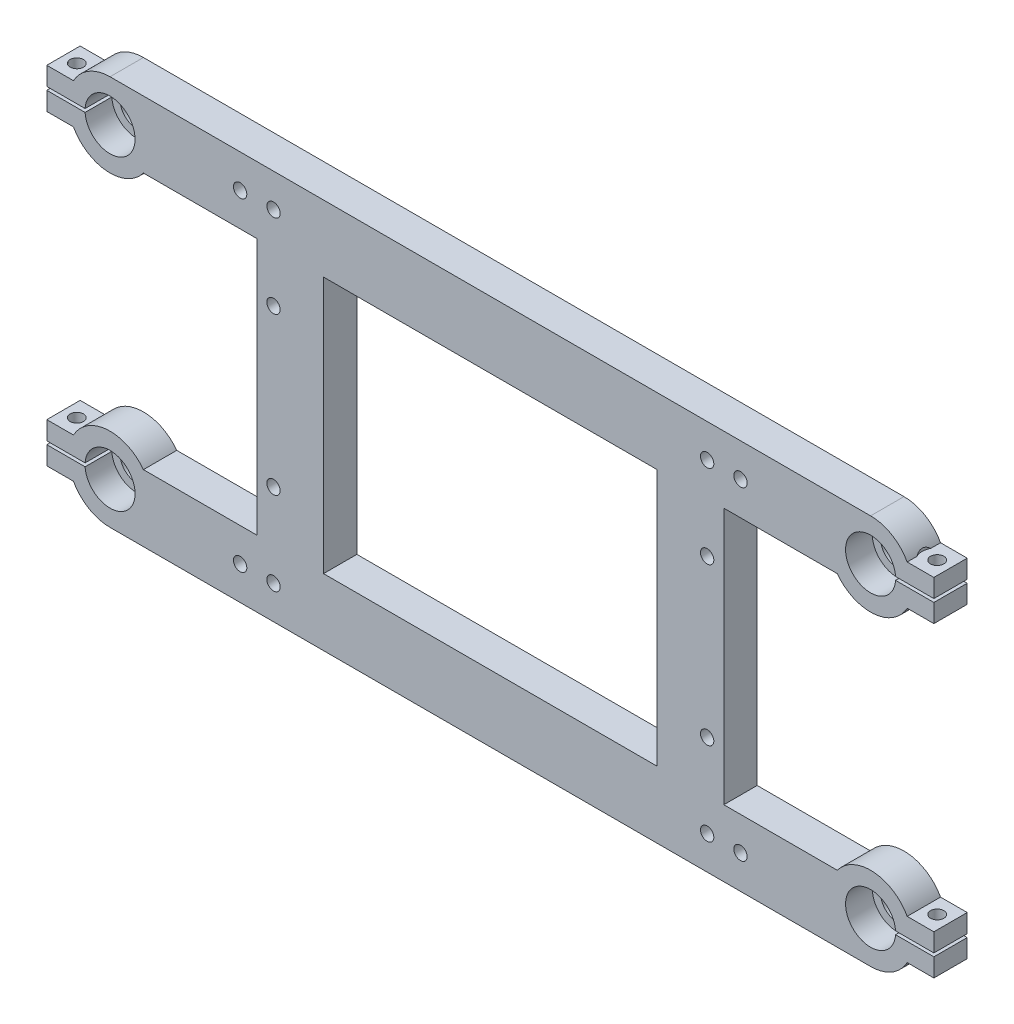
from build123d import *

# Parameters (mm, degrees)
SKETCH_1_R          = 5
SKETCH_1_W          = 100
SKETCH_1_H          = 77
EXTRUDE_1_DEPTH     = 10
SKETCH_3_R          = 7.5
CUT_EXTRUDE_1_DEPTH = 8
CUT_EXTRUDE_2_REACH = 166.385
SKETCH_5_R          = 2
SKETCH_6_W          = 8
SKETCH_6_H          = 12
EXTRUDE_2_DEPTH     = 10
SKETCH_7_W          = 15
SKETCH_7_H          = 1
CUT_EXTRUDE_3_DEPTH = 170.411241918
SKETCH_8_R          = 2
CUT_EXTRUDE_4_DEPTH = 174.176698457
SKETCH_9_R          = 4.5
CUT_EXTRUDE_5_DEPTH = 10
CHAMFER_1_SIZE      = 2


with BuildPart() as part:
    # 草图1 → 凸台-拉伸1 (new body)
    with BuildSketch(Plane.XY):
        with BuildLine():
            Line((-104, 84.5), (-70, 84.5))
            Line((-70, 84.5), (-70, 7.5))
            Line((-70, 7.5), (-104, 7.5))
            ThreePointArc((-104, 7.5), (-125.180339887, 5.590169944), (-114, -12.5))
            Line((-114, -12.5), (114, -12.5))
            ThreePointArc((114, -12.5), (125.180339887, 5.590169944), (104, 7.5))
            Line((104, 7.5), (70, 7.5))
            Line((70, 7.5), (70, 84.5))
            Line((70, 84.5), (104, 84.5))
            ThreePointArc((104, 84.5), (125.180339887, 86.409830056), (114, 104.5))
            Line((114, 104.5), (64, 104.5))
            Line((64, 104.5), (-64, 104.5))
            Line((-64, 104.5), (-114, 104.5))
            ThreePointArc((-114, 104.5), (-125.180339887, 86.409830056), (-104, 84.5))
        make_face()
        with Locations((-114, 0)):
            Circle(SKETCH_1_R, mode=Mode.SUBTRACT)
        with Locations((-114, 92)):
            Circle(SKETCH_1_R, mode=Mode.SUBTRACT)
        with Locations(Location((114, 92, 0), (0, 0, 180))):
            Circle(SKETCH_1_R, mode=Mode.SUBTRACT)
        with Locations(Location((114, 0, 0), (0, 0, 180))):
            Circle(SKETCH_1_R, mode=Mode.SUBTRACT)
        with Locations((0, 46)):
            Rectangle(SKETCH_1_W, SKETCH_1_H, mode=Mode.SUBTRACT)
    extrude(amount=EXTRUDE_1_DEPTH)

    # 草图3 → 切除-拉伸1 (cut)
    with BuildSketch(Plane.XY.offset(10)):
        with Locations((-114, 92)):
            Circle(SKETCH_3_R)
        with Locations((-114, 0)):
            Circle(SKETCH_3_R)
        with Locations(Location((114, 0, 0), (0, 0, 180))):
            Circle(SKETCH_3_R)
        with Locations(Location((114, 92, 0), (0, 0, 180))):
            Circle(SKETCH_3_R)
    extrude(amount=-CUT_EXTRUDE_1_DEPTH, mode=Mode.SUBTRACT)

    # 草图5 → 切除-拉伸2 (cut, up to next)
    with BuildSketch(Plane.XY, mode=Mode.PRIVATE) as cut_extrude_2_sk1:
        with Locations(Location((-65, 94.5, 0), (0, 0, 180))):
            Circle(SKETCH_5_R)
    cut_extrude_2_tool1 = extrude(cut_extrude_2_sk1.sketch, amount=CUT_EXTRUDE_2_REACH, mode=Mode.PRIVATE) & part.part
    # 草图5 → 切除-拉伸2 (cut, up to next)
    with BuildSketch(Plane.XY, mode=Mode.PRIVATE) as cut_extrude_2_sk2:
        with Locations(Location((-75, 94.5, 0), (0, 0, 180))):
            Circle(SKETCH_5_R)
    cut_extrude_2_tool2 = extrude(cut_extrude_2_sk2.sketch, amount=CUT_EXTRUDE_2_REACH, mode=Mode.PRIVATE) & part.part
    # 草图5 → 切除-拉伸2 (cut, up to next)
    with BuildSketch(Plane.XY, mode=Mode.PRIVATE) as cut_extrude_2_sk3:
        with Locations(Location((-65, 69.5, 0), (0, 0, 180))):
            Circle(SKETCH_5_R)
    cut_extrude_2_tool3 = extrude(cut_extrude_2_sk3.sketch, amount=CUT_EXTRUDE_2_REACH, mode=Mode.PRIVATE) & part.part
    # 草图5 → 切除-拉伸2 (cut, up to next)
    with BuildSketch(Plane.XY, mode=Mode.PRIVATE) as cut_extrude_2_sk4:
        with Locations(Location((-65, 22.5, 0), (0, 0, 180))):
            Circle(SKETCH_5_R)
    cut_extrude_2_tool4 = extrude(cut_extrude_2_sk4.sketch, amount=CUT_EXTRUDE_2_REACH, mode=Mode.PRIVATE) & part.part
    # 草图5 → 切除-拉伸2 (cut, up to next)
    with BuildSketch(Plane.XY, mode=Mode.PRIVATE) as cut_extrude_2_sk5:
        with Locations(Location((-65, -2.5, 0), (0, 0, 180))):
            Circle(SKETCH_5_R)
    cut_extrude_2_tool5 = extrude(cut_extrude_2_sk5.sketch, amount=CUT_EXTRUDE_2_REACH, mode=Mode.PRIVATE) & part.part
    # 草图5 → 切除-拉伸2 (cut, up to next)
    with BuildSketch(Plane.XY, mode=Mode.PRIVATE) as cut_extrude_2_sk6:
        with Locations(Location((-75, -2.5, 0), (0, 0, 180))):
            Circle(SKETCH_5_R)
    cut_extrude_2_tool6 = extrude(cut_extrude_2_sk6.sketch, amount=CUT_EXTRUDE_2_REACH, mode=Mode.PRIVATE) & part.part
    # 草图5 → 切除-拉伸2 (cut, up to next)
    with BuildSketch(Plane.XY, mode=Mode.PRIVATE) as cut_extrude_2_sk7:
        with Locations(Location((75, -2.5, 0), (0, 0, 180))):
            Circle(SKETCH_5_R)
    cut_extrude_2_tool7 = extrude(cut_extrude_2_sk7.sketch, amount=CUT_EXTRUDE_2_REACH, mode=Mode.PRIVATE) & part.part
    # 草图5 → 切除-拉伸2 (cut, up to next)
    with BuildSketch(Plane.XY, mode=Mode.PRIVATE) as cut_extrude_2_sk8:
        with Locations(Location((65, -2.5, 0), (0, 0, 180))):
            Circle(SKETCH_5_R)
    cut_extrude_2_tool8 = extrude(cut_extrude_2_sk8.sketch, amount=CUT_EXTRUDE_2_REACH, mode=Mode.PRIVATE) & part.part
    # 草图5 → 切除-拉伸2 (cut, up to next)
    with BuildSketch(Plane.XY, mode=Mode.PRIVATE) as cut_extrude_2_sk9:
        with Locations(Location((65, 22.5, 0), (0, 0, 180))):
            Circle(SKETCH_5_R)
    cut_extrude_2_tool9 = extrude(cut_extrude_2_sk9.sketch, amount=CUT_EXTRUDE_2_REACH, mode=Mode.PRIVATE) & part.part
    # 草图5 → 切除-拉伸2 (cut, up to next)
    with BuildSketch(Plane.XY, mode=Mode.PRIVATE) as cut_extrude_2_sk10:
        with Locations(Location((65, 69.5, 0), (0, 0, 180))):
            Circle(SKETCH_5_R)
    cut_extrude_2_tool10 = extrude(cut_extrude_2_sk10.sketch, amount=CUT_EXTRUDE_2_REACH, mode=Mode.PRIVATE) & part.part
    # 草图5 → 切除-拉伸2 (cut, up to next)
    with BuildSketch(Plane.XY, mode=Mode.PRIVATE) as cut_extrude_2_sk11:
        with Locations(Location((75, 94.5, 0), (0, 0, 180))):
            Circle(SKETCH_5_R)
    cut_extrude_2_tool11 = extrude(cut_extrude_2_sk11.sketch, amount=CUT_EXTRUDE_2_REACH, mode=Mode.PRIVATE) & part.part
    # 草图5 → 切除-拉伸2 (cut, up to next)
    with BuildSketch(Plane.XY, mode=Mode.PRIVATE) as cut_extrude_2_sk12:
        with Locations(Location((65, 94.5, 0), (0, 0, 180))):
            Circle(SKETCH_5_R)
    cut_extrude_2_tool12 = extrude(cut_extrude_2_sk12.sketch, amount=CUT_EXTRUDE_2_REACH, mode=Mode.PRIVATE) & part.part
    add(cut_extrude_2_tool1.solids().sort_by_distance((-65, 94.5, 0))[0], mode=Mode.SUBTRACT)
    add(cut_extrude_2_tool2.solids().sort_by_distance((-75, 94.5, 0))[0], mode=Mode.SUBTRACT)
    add(cut_extrude_2_tool3.solids().sort_by_distance((-65, 69.5, 0))[0], mode=Mode.SUBTRACT)
    add(cut_extrude_2_tool4.solids().sort_by_distance((-65, 22.5, 0))[0], mode=Mode.SUBTRACT)
    add(cut_extrude_2_tool5.solids().sort_by_distance((-65, -2.5, 0))[0], mode=Mode.SUBTRACT)
    add(cut_extrude_2_tool6.solids().sort_by_distance((-75, -2.5, 0))[0], mode=Mode.SUBTRACT)
    add(cut_extrude_2_tool7.solids().sort_by_distance((75, -2.5, 0))[0], mode=Mode.SUBTRACT)
    add(cut_extrude_2_tool8.solids().sort_by_distance((65, -2.5, 0))[0], mode=Mode.SUBTRACT)
    add(cut_extrude_2_tool9.solids().sort_by_distance((65, 22.5, 0))[0], mode=Mode.SUBTRACT)
    add(cut_extrude_2_tool10.solids().sort_by_distance((65, 69.5, 0))[0], mode=Mode.SUBTRACT)
    add(cut_extrude_2_tool11.solids().sort_by_distance((75, 94.5, 0))[0], mode=Mode.SUBTRACT)
    add(cut_extrude_2_tool12.solids().sort_by_distance((65, 94.5, 0))[0], mode=Mode.SUBTRACT)

    # 草图6 → 凸台-拉伸2 (add)
    with BuildSketch(Plane.XY.offset(10)):
        with Locations((128.9658561, 92)):
            Rectangle(SKETCH_6_W, SKETCH_6_H)
        with Locations((128.9658561, 0)):
            Rectangle(SKETCH_6_W, SKETCH_6_H)
        with Locations((-128.9658561, 0)):
            Rectangle(SKETCH_6_W, SKETCH_6_H)
        with Locations((-128.9658561, 92)):
            Rectangle(SKETCH_6_W, SKETCH_6_H)
    extrude(amount=-EXTRUDE_2_DEPTH)

    # 草图7 → 切除-拉伸3 (cut, through all)
    with BuildSketch(Plane.XY.offset(10)):
        with Locations((125.4658561, 92)):
            Rectangle(SKETCH_7_W, SKETCH_7_H)
        with Locations((125.4658561, 0)):
            Rectangle(SKETCH_7_W, SKETCH_7_H)
        with Locations((-125.4658561, 0)):
            Rectangle(SKETCH_7_W, SKETCH_7_H)
        with Locations((-125.4658561, 92)):
            Rectangle(SKETCH_7_W, SKETCH_7_H)
    extrude(amount=-CUT_EXTRUDE_3_DEPTH, mode=Mode.SUBTRACT)

    # 草图8 → 切除-拉伸4 (cut, through all)
    with BuildSketch(Plane(origin=(0, 98, 0), x_dir=(1, 0, 0), z_dir=(0, 1, 0))):
        with Locations(Location((-128.9658561, -5, 0), (0, 0, 180))):
            Circle(SKETCH_8_R)
        with Locations(Location((128.9658561, -5, 0), (0, 0, 90))):
            Circle(SKETCH_8_R)
    extrude(amount=-CUT_EXTRUDE_4_DEPTH, mode=Mode.SUBTRACT)

    # 草图9 → 切除-拉伸5 (cut)
    with BuildSketch(Plane(origin=(0, 98, 0), x_dir=(1, 0, 0), z_dir=(0, 1, 0))):
        with Locations((-128.9658561, -5)):
            Circle(SKETCH_9_R)
        with Locations((128.9658561, -5)):
            Circle(SKETCH_9_R)
    extrude(amount=CUT_EXTRUDE_5_DEPTH, mode=Mode.SUBTRACT)

    # 倒角1
    chamfer_1_edges = [part.edges().sort_by_distance(p)[0] for p in [
        (-73, -2.5, 0),
        (77, -2.5, 0),
        (67, -2.5, 0),
        (67, 22.5, 0),
        (-63, -2.5, 0),
        (-63, 22.5, 0),
        (-63, 69.5, 0),
        (-73, 94.5, 0),
        (67, 94.5, 0),
        (77, 94.5, 0),
        (67, 69.5, 0),
        (-63, 94.5, 0),
    ]]
    chamfer(chamfer_1_edges, length=CHAMFER_1_SIZE)


solid = part.part
